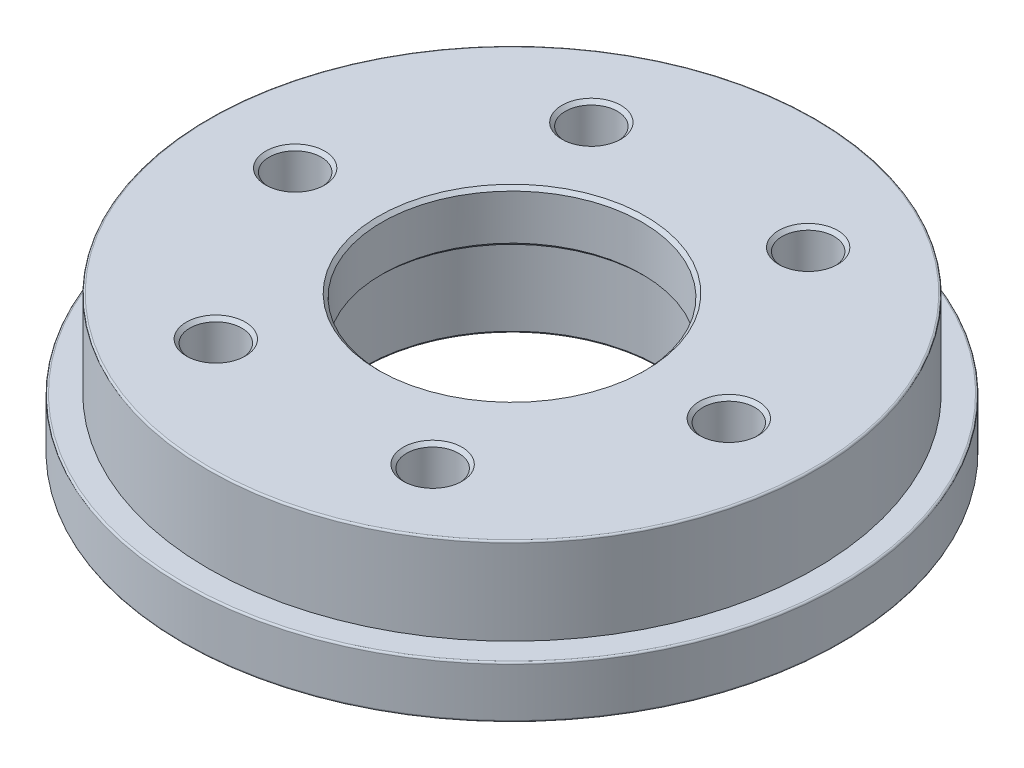
from build123d import *

# Parameters (mm, degrees)
SKETCH_1_R          = 19
EXTRUDE_1_DEPTH     = 3
SKETCH_1_3_R        = 3.05
CUT_EXTRUDE_1_DEPTH = 1.5
SKETCH_5_R          = 17.5
EXTRUDE_3_DEPTH     = 5
SKETCH_7_R          = 8.5
CUT_EXTRUDE_2_DEPTH = 5
SKETCH_8_R          = 7.5
CUT_EXTRUDE_3_DEPTH = 0.5
CUT_EXTRUDE_4_REACH = 30.036
SKETCH_10_R         = 1.5
CUT_EXTRUDE_5_DEPTH = 2
CUT_EXTRUDE_6_REACH = 30.036
SKETCH_12_R         = 7.5
CHAMFER_1_SIZE      = 0.2
FILLET_1_R          = 0.1
FILLET_2_R          = 0.1


with BuildPart() as part:
    # 草图1 → 凸台-拉伸1 (new body)
    with BuildSketch(Plane(origin=(0, 0, 0), x_dir=(1, 0, 0), z_dir=(0, 1, 0))):
        Circle(SKETCH_1_R)
    extrude(amount=EXTRUDE_1_DEPTH)

    # 草图1<3> → 切除-拉伸1 (cut)
    with BuildSketch(Plane(origin=(0, 0, 0), x_dir=(1, 0, 0), z_dir=(0, 1, 0))):
        with Locations((0, 15)):
            Circle(SKETCH_1_3_R)
        with Locations((12.990381057, 7.5)):
            Circle(SKETCH_1_3_R)
        with Locations((12.990381057, -7.5)):
            Circle(SKETCH_1_3_R)
        with Locations((0, -15)):
            Circle(SKETCH_1_3_R)
        with Locations((-12.990381057, -7.5)):
            Circle(SKETCH_1_3_R)
        with Locations((-12.990381057, 7.5)):
            Circle(SKETCH_1_3_R)
    extrude(amount=CUT_EXTRUDE_1_DEPTH, mode=Mode.SUBTRACT)

    # 草图5 → 凸台-拉伸3 (add)
    with BuildSketch(Plane(origin=(0, 3, 0), x_dir=(1, 0, 0), z_dir=(0, 1, 0))):
        Circle(SKETCH_5_R)
    extrude(amount=EXTRUDE_3_DEPTH)

    # 草图7 → 切除-拉伸2 (cut)
    with BuildSketch(Plane.XZ):
        Circle(SKETCH_7_R)
    extrude(amount=-CUT_EXTRUDE_2_DEPTH, mode=Mode.SUBTRACT)

    # 草图8 → 切除-拉伸3 (cut)
    with BuildSketch(Plane.XZ.offset(-5)):
        Circle(SKETCH_8_R)
    extrude(amount=-CUT_EXTRUDE_3_DEPTH, mode=Mode.SUBTRACT)

    # 草图10 → 切除-拉伸4 (cut, up to next)
    with BuildSketch(Plane.XZ, mode=Mode.PRIVATE) as cut_extrude_4_sk1:
        with Locations((6.25, 10.825317547)):
            Circle(SKETCH_10_R)
    cut_extrude_4_tool1 = extrude(cut_extrude_4_sk1.sketch, amount=-CUT_EXTRUDE_4_REACH, mode=Mode.PRIVATE) & part.part
    # 草图10 → 切除-拉伸4 (cut, up to next)
    with BuildSketch(Plane.XZ, mode=Mode.PRIVATE) as cut_extrude_4_sk2:
        with Locations((12.5, 0)):
            Circle(SKETCH_10_R)
    cut_extrude_4_tool2 = extrude(cut_extrude_4_sk2.sketch, amount=-CUT_EXTRUDE_4_REACH, mode=Mode.PRIVATE) & part.part
    # 草图10 → 切除-拉伸4 (cut, up to next)
    with BuildSketch(Plane.XZ, mode=Mode.PRIVATE) as cut_extrude_4_sk3:
        with Locations((6.25, -10.825317547)):
            Circle(SKETCH_10_R)
    cut_extrude_4_tool3 = extrude(cut_extrude_4_sk3.sketch, amount=-CUT_EXTRUDE_4_REACH, mode=Mode.PRIVATE) & part.part
    # 草图10 → 切除-拉伸4 (cut, up to next)
    with BuildSketch(Plane.XZ, mode=Mode.PRIVATE) as cut_extrude_4_sk4:
        with Locations((-6.25, -10.825317547)):
            Circle(SKETCH_10_R)
    cut_extrude_4_tool4 = extrude(cut_extrude_4_sk4.sketch, amount=-CUT_EXTRUDE_4_REACH, mode=Mode.PRIVATE) & part.part
    # 草图10 → 切除-拉伸4 (cut, up to next)
    with BuildSketch(Plane.XZ, mode=Mode.PRIVATE) as cut_extrude_4_sk5:
        with Locations((-12.5, 0)):
            Circle(SKETCH_10_R)
    cut_extrude_4_tool5 = extrude(cut_extrude_4_sk5.sketch, amount=-CUT_EXTRUDE_4_REACH, mode=Mode.PRIVATE) & part.part
    # 草图10 → 切除-拉伸4 (cut, up to next)
    with BuildSketch(Plane.XZ, mode=Mode.PRIVATE) as cut_extrude_4_sk6:
        with Locations((-6.25, 10.825317547)):
            Circle(SKETCH_10_R)
    cut_extrude_4_tool6 = extrude(cut_extrude_4_sk6.sketch, amount=-CUT_EXTRUDE_4_REACH, mode=Mode.PRIVATE) & part.part
    add(cut_extrude_4_tool1.solids().sort_by_distance((6.25, 0, 10.825318))[0], mode=Mode.SUBTRACT)
    add(cut_extrude_4_tool2.solids().sort_by_distance((12.5, 0, 0))[0], mode=Mode.SUBTRACT)
    add(cut_extrude_4_tool3.solids().sort_by_distance((6.25, 0, -10.825318))[0], mode=Mode.SUBTRACT)
    add(cut_extrude_4_tool4.solids().sort_by_distance((-6.25, 0, -10.825318))[0], mode=Mode.SUBTRACT)
    add(cut_extrude_4_tool5.solids().sort_by_distance((-12.5, 0, 0))[0], mode=Mode.SUBTRACT)
    add(cut_extrude_4_tool6.solids().sort_by_distance((-6.25, 0, 10.825318))[0], mode=Mode.SUBTRACT)

    # 草图11 → 切除-拉伸5 (cut)
    with BuildSketch(Plane.XZ):
        Polygon((6.25, -14.000744028), (9, -12.413030788), (9, -9.237604307), (6.25, -7.649891067), (3.5, -9.237604307), (3.5, -12.413030788), align=None)
        Polygon((15.25, -1.58771324), (15.25, 1.58771324), (12.5, 3.175426481), (9.75, 1.58771324), (9.75, -1.58771324), (12.5, -3.175426481), align=None)
        Polygon((-9, -12.413030788), (-6.25, -14.000744028), (-3.5, -12.413030788), (-3.5, -9.237604307), (-6.25, -7.649891067), (-9, -9.237604307), align=None)
        Polygon((-15.25, 1.58771324), (-15.25, -1.58771324), (-12.5, -3.175426481), (-9.75, -1.58771324), (-9.75, 1.58771324), (-12.5, 3.175426481), align=None)
        Polygon((-6.25, 14.000744028), (-9, 12.413030788), (-9, 9.237604307), (-6.25, 7.649891067), (-3.5, 9.237604307), (-3.5, 12.413030788), align=None)
        Polygon((9, 12.413030788), (6.25, 14.000744028), (3.5, 12.413030788), (3.5, 9.237604307), (6.25, 7.649891067), (9, 9.237604307), align=None)
    extrude(amount=-CUT_EXTRUDE_5_DEPTH, mode=Mode.SUBTRACT)

    # 草图12 → 切除-拉伸6 (cut, up to next)
    with BuildSketch(Plane(origin=(0, 8, 0), x_dir=(1, 0, 0), z_dir=(0, 1, 0)), mode=Mode.PRIVATE) as cut_extrude_6_sk1:
        Circle(SKETCH_12_R)
    cut_extrude_6_tool1 = extrude(cut_extrude_6_sk1.sketch, amount=-CUT_EXTRUDE_6_REACH, mode=Mode.PRIVATE) & part.part
    add(cut_extrude_6_tool1.solids().sort_by_distance((0, 8, 0))[0], mode=Mode.SUBTRACT)

    # 倒角1
    chamfer_1_edges = [part.edges().sort_by_distance(p)[0] for p in [
        (-14, 2, 0),
        (-14, 8, 0),
        (-7.75, 2, 10.825317547),
        (-7.75, 8, 10.825317547),
        (4.75, 2, 10.825317547),
        (4.75, 8, 10.825317547),
        (11, 2, 0),
        (11, 8, 0),
        (4.75, 2, -10.825317547),
        (4.75, 8, -10.825317547),
        (-7.75, 2, -10.825317547),
        (-7.75, 8, -10.825317547),
        (-7.5, 8, 0),
        (-7.5, 5, 0),
    ]]
    chamfer(chamfer_1_edges, length=CHAMFER_1_SIZE)

    # 圆角1
    fillet_1_edges = [part.edges().sort_by_distance(p)[0] for p in [
        (-19, 0, 0),
        (-19, 3, 0),
        (-8.5, 0, 0),
        (-17.5, 8, 0),
    ]]
    fillet(fillet_1_edges, radius=FILLET_1_R)

    # 圆角2
    fillet_2_edges = [part.edges().sort_by_distance(p)[0] for p in [
        (9.940381057, 0, 7.5),
        (9.940381057, 0, -7.5),
        (-3.05, 0, -15),
        (-16.040381057, 0, -7.5),
        (-16.040381057, 0, 7.5),
        (-3.05, 0, 15),
    ]]
    fillet(fillet_2_edges, radius=FILLET_2_R)


solid = part.part
